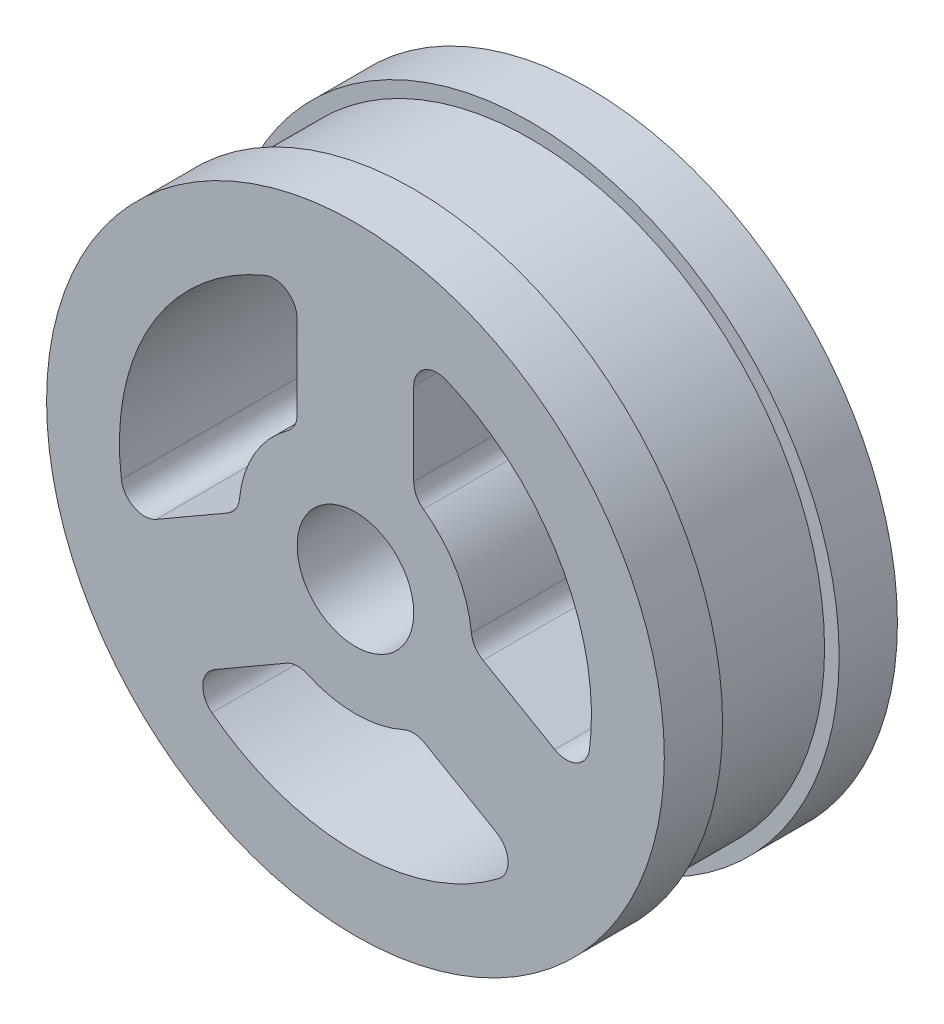
from build123d import *

# Parameters (mm, degrees)
SKETCH1_R           = 26.5
BOSS_EXTRUDE1_DEPTH = 5
SKETCH2_R           = 25.25
BOSS_EXTRUDE2_DEPTH = 10
SKETCH3_R           = 26.5
BOSS_EXTRUDE3_DEPTH = 5
SKETCH4_R           = 5
CUT_EXTRUDE1_DEPTH  = 43.479406776
CUT_EXTRUDE2_DEPTH  = 43.479406776
FILLET1_R           = 2


with BuildPart() as part:
    # Sketch1 → Boss-Extrude1 (new body)
    with BuildSketch(Plane.XY):
        Circle(SKETCH1_R)
    extrude(amount=BOSS_EXTRUDE1_DEPTH)

    # Sketch2 → Boss-Extrude2 (add)
    with BuildSketch(Plane.XY.offset(5)):
        Circle(SKETCH2_R)
    extrude(amount=BOSS_EXTRUDE2_DEPTH)

    # Sketch3 → Boss-Extrude3 (add)
    with BuildSketch(Plane.XY.offset(15)):
        Circle(SKETCH3_R)
    extrude(amount=BOSS_EXTRUDE3_DEPTH)

    # Sketch4 → Cut-Extrude1 (cut, through all)
    with BuildSketch(Plane.XY.offset(20)):
        Circle(SKETCH4_R)
    extrude(amount=-CUT_EXTRUDE1_DEPTH, mode=Mode.SUBTRACT)

    # Sketch6 → Cut-Extrude2 (cut, through all)
    with BuildSketch(Plane.XY.offset(20)):
        with BuildLine():
            ThreePointArc((-10, 0), (-8.660254038, 5), (-5, 8.660254038))
            Line((-5, 8.660254038), (-5, 19.623009453))
            ThreePointArc((-5, 19.623009453), (-17.537014427, 10.125), (-19.494024685, -5.481377708))
            Line((-19.494024685, -5.481377708), (-10, 0))
        make_face()
        with BuildLine():
            Line((14.494024685, -14.141631746), (5, -8.660254038))
            ThreePointArc((5, -8.660254038), (0, -10), (-5, -8.660254038))
            Line((-5, -8.660254038), (-14.494024685, -14.141631746))
            ThreePointArc((-14.494024685, -14.141631746), (0, -20.25), (14.494024685, -14.141631746))
        make_face()
        with BuildLine():
            Line((5, 19.623009453), (5, 8.660254038))
            ThreePointArc((5, 8.660254038), (8.660254038, 5), (10, 0))
            Line((10, 0), (19.494024685, -5.481377708))
            ThreePointArc((19.494024685, -5.481377708), (20.0601159, -2.766631537), (20.25, 0))
            ThreePointArc((20.25, 0), (15.989254204, 12.426031144), (5, 19.623009453))
        make_face()
    extrude(amount=-CUT_EXTRUDE2_DEPTH, mode=Mode.SUBTRACT)

    # Fillet1
    fillet1_edges = [part.edges().sort_by_distance(p)[0] for p in [
        (10, 0, 10),
        (5, 8.660254038, 10),
        (5, 19.623009453, 10),
        (19.494024685, -5.481377708, 10),
        (-5, -8.660254038, 10),
        (5, -8.660254038, 10),
        (14.494024685, -14.141631746, 10),
        (-14.494024685, -14.141631746, 10),
        (-5, 8.660254038, 10),
        (-10, 0, 10),
        (-19.494024685, -5.481377708, 10),
        (-5, 19.623009453, 10),
    ]]
    fillet(fillet1_edges, radius=FILLET1_R)


solid = part.part
